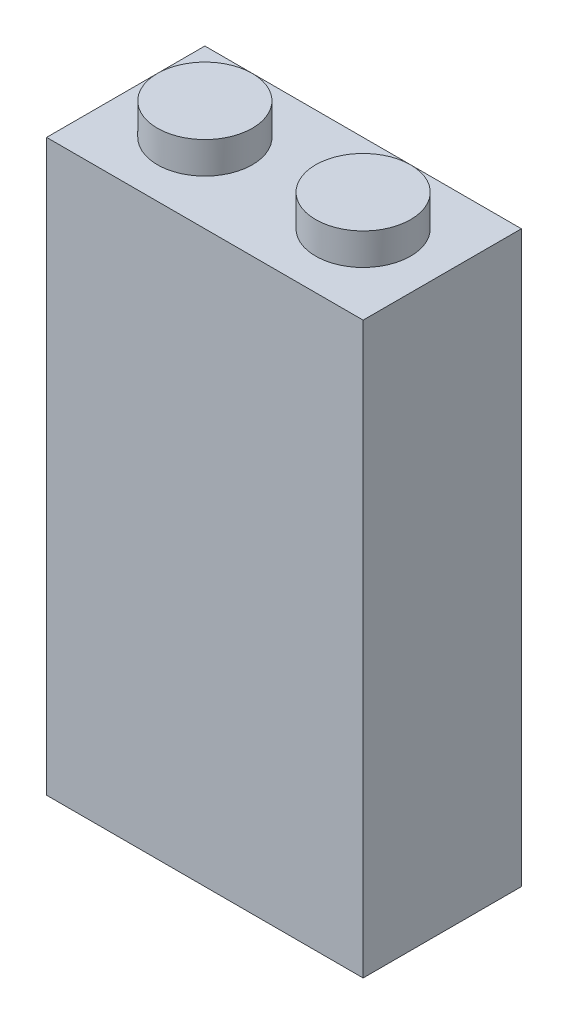
from build123d import *

# Parameters (mm, degrees)
SKETCH1_W            = 16
SKETCH1_H            = 8
BOSS_EXTRUDE1_DEPTH  = 28.8
SKETCH2_R            = 2.4
BOSS_EXTRUDE2_DEPTH  = 1.6
LPATTERN1_COUNT      = 2
LPATTERN1_PITCH      = 8
LPATTERN1_COUNT_DIR2 = 4
LPATTERN1_PITCH_DIR2 = 8
SHELL1_T             = -1.6


with BuildPart() as part:
    # Sketch1 → Boss-Extrude1 (new body)
    with BuildSketch(Plane(origin=(0, 0, 0), x_dir=(1, 0, 0), z_dir=(0, 1, 0))):
        with Locations((8, 4)):
            Rectangle(SKETCH1_W, SKETCH1_H)
    extrude(amount=BOSS_EXTRUDE1_DEPTH)

    # Sketch2 → Boss-Extrude2 (add)
    with BuildSketch(Plane(origin=(0, 28.8, 0), x_dir=(1, 0, 0), z_dir=(0, 1, 0))):
        with Locations(Location((12, 4, 0), (0, 0, 90))):
            Circle(SKETCH2_R)
    boss_extrude2 = extrude(amount=BOSS_EXTRUDE2_DEPTH)

    # LPattern1: Boss-Extrude2 2 × 4, 6 skipped
    with Locations(*[(-i * LPATTERN1_PITCH, 0, -j * LPATTERN1_PITCH_DIR2) for i in range(LPATTERN1_COUNT) for j in range(LPATTERN1_COUNT_DIR2) if (i, j) not in ((0, 0), (0, 1), (0, 2), (0, 3), (1, 1), (1, 2), (1, 3))]):
        add(boss_extrude2)

    # Shell1
    shell1_openings = [part.faces().sort_by_distance(p)[0] for p in [
        (8, 0, -4),
    ]]
    offset(amount=SHELL1_T, openings=shell1_openings, kind=Kind.INTERSECTION)


solid = part.part
